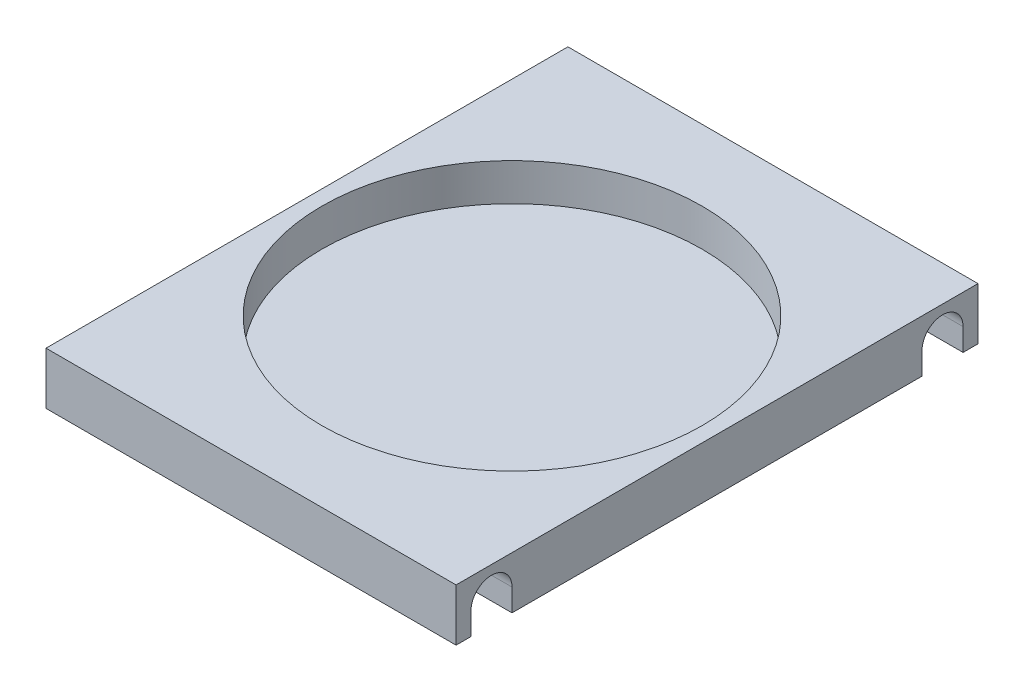
from build123d import *

# Parameters (mm, degrees)
SKETCH2_W           = 55
SKETCH2_H           = 70
BOSS_EXTRUDE1_DEPTH = 8
SKETCH3_R           = 25.5
CUT_EXTRUDE1_DEPTH  = 5
CUT_EXTRUDE3_DEPTH  = 125
SKETCH6_W           = 70
SKETCH6_H           = 1
CUT_EXTRUDE4_DEPTH  = 125


with BuildPart() as part:
    # Sketch2 → Boss-Extrude1 (new body)
    with BuildSketch(Plane(origin=(0, 0, 0), x_dir=(1, 0, 0), z_dir=(0, 1, 0))):
        Rectangle(SKETCH2_W, SKETCH2_H)
    extrude(amount=BOSS_EXTRUDE1_DEPTH)

    # Sketch3 → Cut-Extrude1 (cut)
    with BuildSketch(Plane(origin=(0, 8, 0), x_dir=(1, 0, 0), z_dir=(0, 1, 0))):
        with Locations(Location((0, 0, 0), (0, 0, 270))):
            Circle(SKETCH3_R)
    extrude(amount=-CUT_EXTRUDE1_DEPTH, mode=Mode.SUBTRACT)

    # Sketch4 → Cut-Extrude3 (cut)
    with BuildSketch(Plane(origin=(27.5, 0, 0), x_dir=(0, 0, -1), z_dir=(1, 0, 0))):
        with BuildLine():
            Line((-30.25, 0), (-30.25, 1.25))
            ThreePointArc((-30.25, 1.25), (-32.194543648, 2.055456352), (-33, 4))
            Line((-33, 4), (-33, 0))
            Line((-33, 0), (-30.25, 0))
        make_face()
        with BuildLine():
            ThreePointArc((-27.5, 4), (-28.305456352, 2.055456352), (-30.25, 1.25))
            Line((-30.25, 1.25), (-30.25, 0))
            Line((-30.25, 0), (-27.5, 0))
            Line((-27.5, 0), (-27.5, 4))
        make_face()
        with BuildLine():
            ThreePointArc((-27.5, 4), (-28.305456352, 5.944543648), (-30.25, 6.75))
            Line((-30.25, 6.75), (-30.25, 1.25))
            ThreePointArc((-30.25, 1.25), (-28.305456352, 2.055456352), (-27.5, 4))
        make_face()
        with BuildLine():
            Line((-30.25, 1.25), (-30.25, 6.75))
            ThreePointArc((-30.25, 6.75), (-32.194543648, 5.944543648), (-33, 4))
            ThreePointArc((-33, 4), (-32.194543648, 2.055456352), (-30.25, 1.25))
        make_face()
    cut_extrude3 = extrude(amount=-CUT_EXTRUDE3_DEPTH, mode=Mode.SUBTRACT)

    # Mirror1: Cut-Extrude3 across plane
    add(cut_extrude3.mirror(Plane.XY), mode=Mode.SUBTRACT)

    # Sketch6 → Cut-Extrude4 (cut)
    with BuildSketch(Plane(origin=(27.5, 0, 0), x_dir=(0, 0, -1), z_dir=(1, 0, 0))):
        with Locations((0, 0.5)):
            Rectangle(SKETCH6_W, SKETCH6_H)
    extrude(amount=-CUT_EXTRUDE4_DEPTH, mode=Mode.SUBTRACT)


solid = part.part
